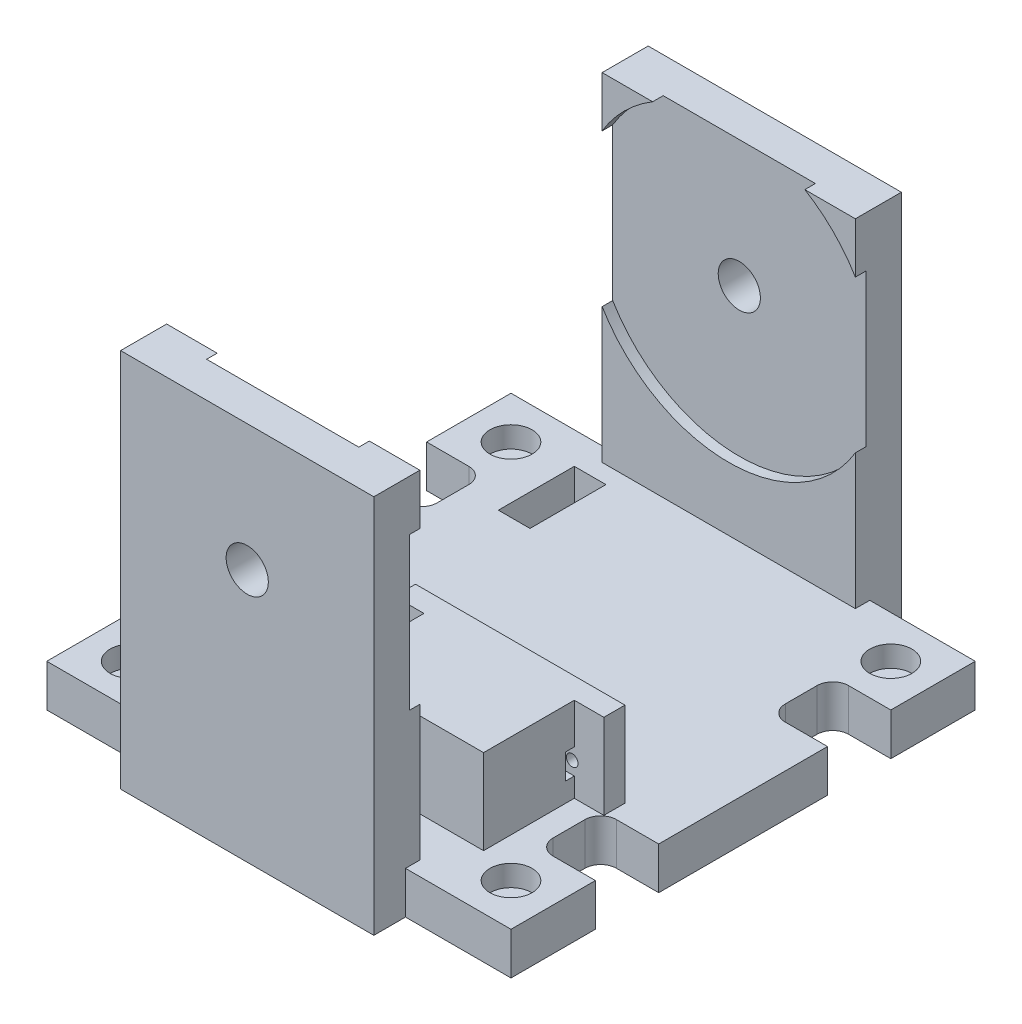
from build123d import *

# Parameters (mm, degrees)
BOSS_EXTRUDE1_DEPTH = 8
SKETCH2_R           = 1.651
CUT_EXTRUDE1_DEPTH  = 63.737548565
SKETCH3_R           = 4
CUT_EXTRUDE2_DEPTH  = 4
BOSS_EXTRUDE2_DEPTH = 12.1
BOSS_EXTRUDE3_DEPTH = 4
SKETCH6_R           = 1.1
CUT_EXTRUDE4_DEPTH  = 4
SKETCH7_W           = 1.6764
SKETCH7_H           = 4.7752
CUT_EXTRUDE5_DEPTH  = 89.164959026
SKETCH8_W           = 48
SKETCH8_H           = 2.725
BOSS_EXTRUDE4_DEPTH = 64
SKETCH9_W           = 48
SKETCH9_H           = 72
BOSS_EXTRUDE5_DEPTH = 6
SKETCH10_R          = 28
CUT_EXTRUDE6_DEPTH  = 2
SKETCH12_R          = 4
CUT_EXTRUDE7_DEPTH  = 126.778478386
SKETCH13_W          = 6
SKETCH13_H          = 14.4
CUT_EXTRUDE8_DEPTH  = 99.081598682


with BuildPart() as part:
    # Sketch1 → Boss-Extrude1 (new body)
    with BuildSketch(Plane(origin=(0, 0, 0), x_dir=(1, 0, 0), z_dir=(0, 1, 0))):
        with BuildLine():
            Line((-44, 28), (-36, 28))
            ThreePointArc((-36, 28), (-33.878679656, 27.121320344), (-33, 25))
            Line((-33, 25), (-33, 19))
            ThreePointArc((-33, 19), (-33.878679656, 16.878679656), (-36, 16))
            Line((-36, 16), (-44, 16))
            Line((-44, 16), (-44, -16))
            Line((-44, -16), (-36, -16))
            ThreePointArc((-36, -16), (-33.878679656, -16.878679656), (-33, -19))
            Line((-33, -19), (-33, -25))
            ThreePointArc((-33, -25), (-33.878679656, -27.121320344), (-36, -28))
            Line((-36, -28), (-44, -28))
            Line((-44, -28), (-44, -44))
            Line((-44, -44), (44, -44))
            Line((44, -44), (44, -28))
            Line((44, -28), (36, -28))
            ThreePointArc((36, -28), (33.878679656, -27.121320344), (33, -25))
            Line((33, -25), (33, -19))
            ThreePointArc((33, -19), (33.878679656, -16.878679656), (36, -16))
            Line((36, -16), (44, -16))
            Line((44, -16), (44, 16))
            Line((44, 16), (36, 16))
            ThreePointArc((36, 16), (33.878679656, 16.878679656), (33, 19))
            Line((33, 19), (33, 25))
            ThreePointArc((33, 25), (33.878679656, 27.121320344), (36, 28))
            Line((36, 28), (44, 28))
            Line((44, 28), (44, 44))
            Line((44, 44), (-44, 44))
            Line((-44, 44), (-44, 28))
        make_face()
    extrude(amount=BOSS_EXTRUDE1_DEPTH)

    # Sketch2 → Cut-Extrude1 (cut, through all)
    with BuildSketch(Plane(origin=(0, 8, 0), x_dir=(1, 0, 0), z_dir=(0, 1, 0))):
        with Locations(Location((-36, 36, 0), (0, 0, 270))):
            Circle(SKETCH2_R)
        with Locations(Location((36, 36, 0), (0, 0, 90))):
            Circle(SKETCH2_R)
        with Locations(Location((36, -36, 0), (0, 0, 270))):
            Circle(SKETCH2_R)
        with Locations(Location((-36, -36, 0), (0, 0, 90))):
            Circle(SKETCH2_R)
    extrude(amount=-CUT_EXTRUDE1_DEPTH, mode=Mode.SUBTRACT)

    # Sketch3 → Cut-Extrude2 (cut)
    with BuildSketch(Plane(origin=(0, 8, 0), x_dir=(1, 0, 0), z_dir=(0, 1, 0))):
        with Locations(Location((-36, 36, 0), (0, 0, 270))):
            Circle(SKETCH3_R)
        with Locations(Location((36, 36, 0), (0, 0, 270))):
            Circle(SKETCH3_R)
        with Locations(Location((36, -36, 0), (0, 0, 270))):
            Circle(SKETCH3_R)
        with Locations(Location((-36, -36, 0), (0, 0, 270))):
            Circle(SKETCH3_R)
    extrude(amount=-CUT_EXTRUDE2_DEPTH, mode=Mode.SUBTRACT)

    # Sketch4 → Boss-Extrude2 (add)
    with BuildSketch(Plane(origin=(0, 8, 0), x_dir=(1, 0, 0), z_dir=(0, 1, 0))):
        Polygon((0, -12.5), (3, -12.5), (3, -30.7), (25.5, -30.7), (25.5, -12.5), (28.5, -12.5), (34.1, -12.5), (34.1, -16.5), (28.5, -16.5), (28.5, -33.7), (0, -33.7), (0, -16.5), (-5.6, -16.5), (-5.6, -12.5), align=None)
    extrude(amount=BOSS_EXTRUDE2_DEPTH)

    # Sketch5 → Boss-Extrude3 (add)
    with BuildSketch(Plane(origin=(0, 20.1, 0), x_dir=(1, 0, 0), z_dir=(0, 1, 0))):
        Polygon((3, -12.5), (25.5, -12.5), (34.1, -12.5), (34.1, -16.5), (28.5, -16.5), (28.5, -33.7), (0, -33.7), (0, -16.5), (-5.6, -16.5), (-5.6, -12.5), align=None)
    extrude(amount=BOSS_EXTRUDE3_DEPTH)

    # Sketch6 → Cut-Extrude4 (cut)
    with BuildSketch(Plane(origin=(0, 0, 12.5), x_dir=(-1, 0, 0), z_dir=(0, 0, -1))):
        with Locations((-28.1, 14.05)):
            Circle(SKETCH6_R)
        with Locations((-0.4, 14.05)):
            Circle(SKETCH6_R)
    extrude(amount=-CUT_EXTRUDE4_DEPTH, mode=Mode.SUBTRACT)

    # Sketch7 → Cut-Extrude5 (cut, through all)
    with BuildSketch(Plane(origin=(28.5, 0, 0), x_dir=(0, 0, -1), z_dir=(1, 0, 0))):
        with Locations((-17.3382, 14.05)):
            Rectangle(SKETCH7_W, SKETCH7_H)
    extrude(amount=-CUT_EXTRUDE5_DEPTH, mode=Mode.SUBTRACT)

    # Sketch8 → Boss-Extrude4 (add)
    with BuildSketch(Plane(origin=(0, 8, 0), x_dir=(1, 0, 0), z_dir=(0, 1, 0))):
        with Locations((0, 42.6375)):
            Rectangle(SKETCH8_W, SKETCH8_H)
        with Locations((0, -42.6375)):
            Rectangle(SKETCH8_W, SKETCH8_H)
    extrude(amount=BOSS_EXTRUDE4_DEPTH)

    # Sketch9 → Boss-Extrude5 (add)
    with BuildSketch(Plane.XY.offset(44)):
        with Locations((0, 36)):
            Rectangle(SKETCH9_W, SKETCH9_H)
    boss_extrude5 = extrude(amount=BOSS_EXTRUDE5_DEPTH)

    # Mirror1: Boss-Extrude5 across plane
    add(boss_extrude5.mirror(Plane.XY))

    # Sketch10 → Cut-Extrude6 (cut)
    with BuildSketch(Plane(origin=(0, 0, 41.275), x_dir=(-1, 0, 0), z_dir=(0, 0, -1))):
        with Locations((0, 48)):
            Circle(SKETCH10_R)
    cut_extrude6 = extrude(amount=-CUT_EXTRUDE6_DEPTH, mode=Mode.SUBTRACT)

    # Sketch12 → Cut-Extrude7 (cut, through all)
    with BuildSketch(Plane(origin=(0, 0, 43.275), x_dir=(-1, 0, 0), z_dir=(0, 0, -1))):
        with Locations((0, 48)):
            Circle(SKETCH12_R)
    cut_extrude7 = extrude(amount=-CUT_EXTRUDE7_DEPTH, mode=Mode.SUBTRACT)

    # Mirror2: Cut-Extrude6, Cut-Extrude7 across plane
    add(cut_extrude6.mirror(Plane.XY), mode=Mode.SUBTRACT)
    add(cut_extrude7.mirror(Plane.XY), mode=Mode.SUBTRACT)

    # Sketch13 → Cut-Extrude8 (cut, through all)
    with BuildSketch(Plane.XZ):
        with Locations((-23, -30.8)):
            Rectangle(SKETCH13_W, SKETCH13_H)
    extrude(amount=-CUT_EXTRUDE8_DEPTH, mode=Mode.SUBTRACT)


solid = part.part
